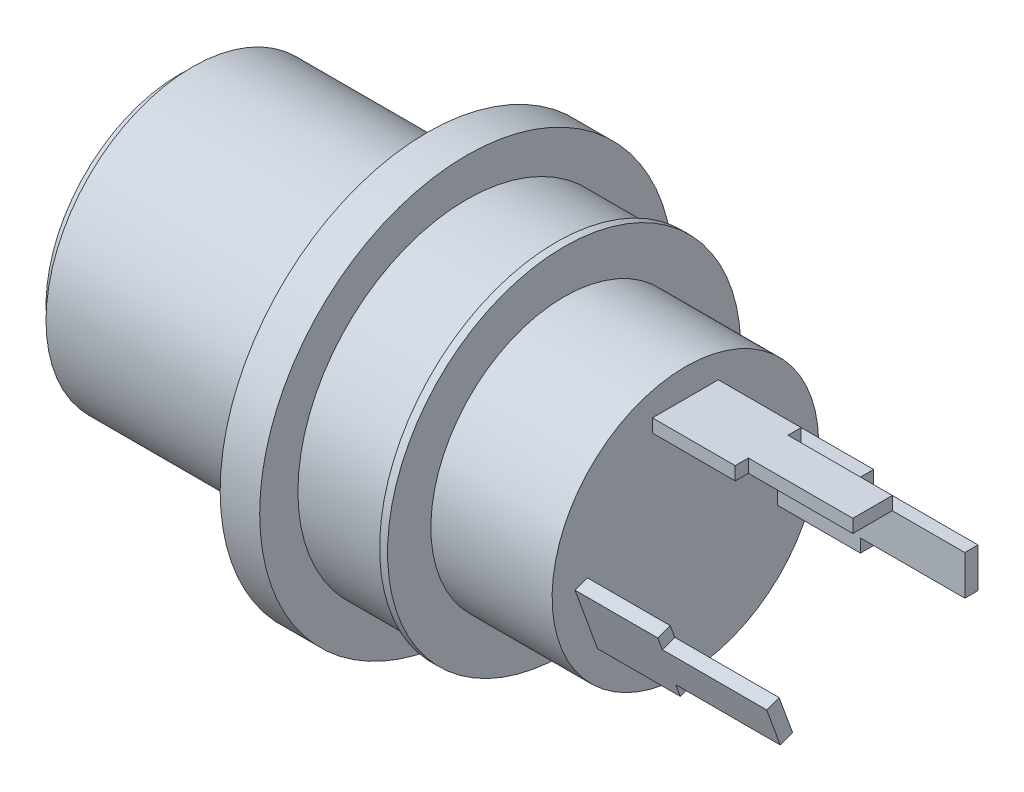
from build123d import *

# Parameters (mm, degrees)
SKETCH2_R           = 3.55625
CUT_EXTRUDE1_DEPTH  = 7.9
SKETCH3_W           = 2.5
SKETCH3_H           = 0.5
SKETCH3_W_2         = 0.5
SKETCH3_H_2         = 2.5
EXTRUDE_THIN1_DEPTH = 7.1
SKETCH4_W           = 0.5
SKETCH4_H           = 0.5
CUT_EXTRUDE3_DEPTH  = 3.96


with BuildPart() as part:
    # Sketch1 → Revolve1 (revolve)
    with BuildSketch(Plane.XY):
        Polygon((-19.2, 0), (-19.2, 5.05625), (-18.7, 5.05625), (-18.7, 5.55625), (-9.8, 5.55625), (-9.8, 7.85), (-8.3, 7.85), (-8.3, 6.4), (-4.9, 6.4), (-4.9, 6.7), (-4.6, 6.7), (-4.6, 5.05625), (0, 5.05625), (0, 0), align=None)
    revolve(axis=Axis((0, 0, 0), (-1, 0, 0)))

    # Sketch2 → Cut-Extrude1 (cut)
    with BuildSketch(Plane.ZY.offset(19.2)):
        with Locations(Location((0, 0, 0), (0, 0, 270))):
            Circle(SKETCH2_R)
    extrude(amount=-CUT_EXTRUDE1_DEPTH, mode=Mode.SUBTRACT)

    # Sketch3 → Extrude-Thin1 (add)
    with BuildSketch(Plane(origin=(0, 0, 0), x_dir=(0, 0, -1), z_dir=(1, 0, 0))):
        with Locations((0, 3.75)):
            Rectangle(SKETCH3_W, SKETCH3_H)
        with Locations((3.75, 0)):
            Rectangle(SKETCH3_W_2, SKETCH3_H_2)
        Polygon((-4.186295662, -0.193464797), (-3.331245304, -2.542696349), (-2.861398994, -2.371686278), (-3.716449352, -0.022454726), align=None)
    extrude(amount=EXTRUDE_THIN1_DEPTH)

    # Sketch4 → Cut-Extrude3 (cut)
    with BuildSketch(Plane(origin=(7.1, 0, 0), x_dir=(0, 0, -1), z_dir=(1, 0, 0))):
        with Locations((-1, 3.75)):
            Rectangle(SKETCH4_W, SKETCH4_H)
        with Locations((1, 3.75)):
            Rectangle(SKETCH4_W, SKETCH4_H)
        with Locations((3.75, 1)):
            Rectangle(SKETCH4_W, SKETCH4_H)
        with Locations((3.75, -1)):
            Rectangle(SKETCH4_W, SKETCH4_H)
        Polygon((-3.331245304, -2.542696349), (-2.861398994, -2.371686278), (-3.032409065, -1.901839967), (-3.502255376, -2.072850039), align=None)
        Polygon((-3.716449352, -0.022454726), (-4.186295662, -0.193464797), (-4.015285591, -0.663311108), (-3.54543928, -0.492301036), align=None)
    extrude(amount=-CUT_EXTRUDE3_DEPTH, mode=Mode.SUBTRACT)


solid = part.part
